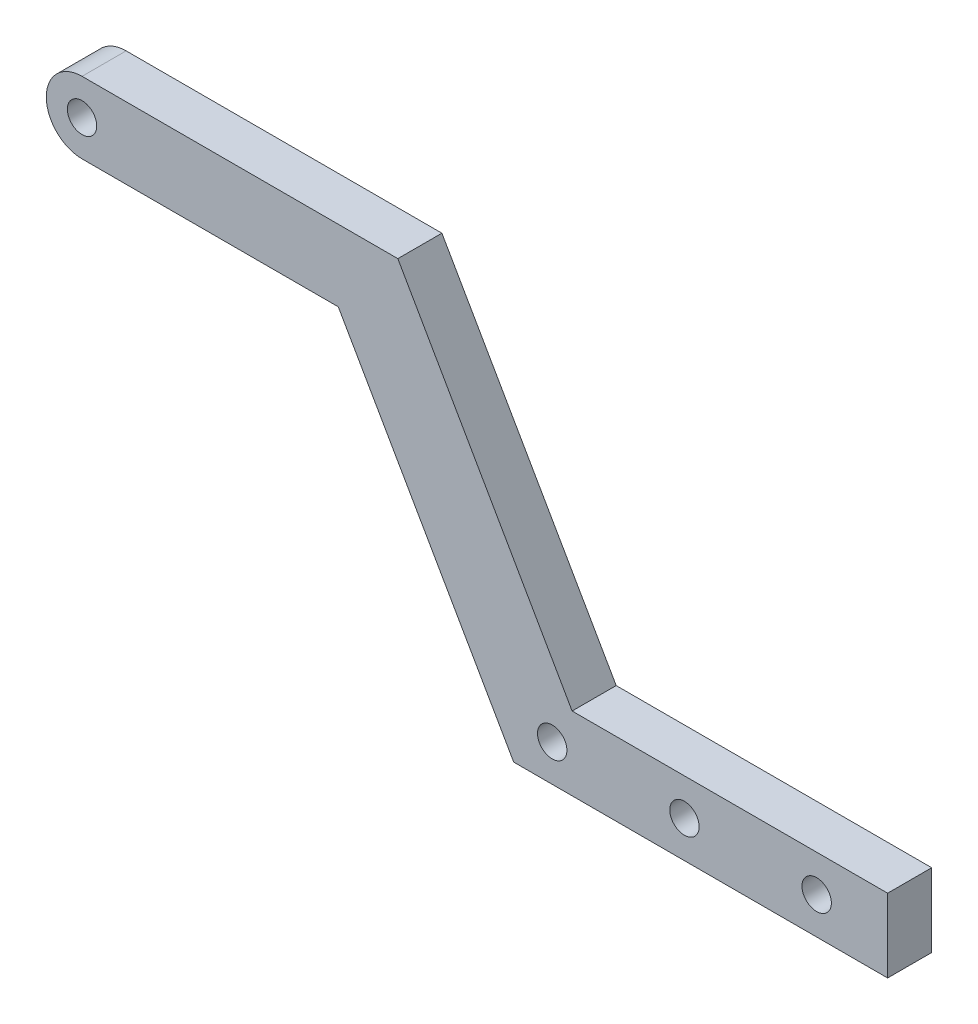
from build123d import *

# Parameters (mm, degrees)
SKETCH_1_R      = 1.000011627
SKETCH_1_R_2    = 1.000010171
SKETCH_1_R_3    = 1.000011034
SKETCH_1_R_4    = 1
EXTRUDE_1_DEPTH = 3


with BuildPart() as part:
    # 草图1 → 凸台-拉伸1 (new body)
    with BuildSketch(Plane.XY):
        with BuildLine():
            Line((28.616000433, -12.942129643), (28.616000433, -7.942129643))
            Line((28.616000433, -7.942129643), (7.141456549, -7.942129643))
            Line((7.141456549, -7.942129643), (-4.721197167, 12.792497513))
            Line((-4.721197167, 12.792497513), (-26.213755395, 12.792497513))
            ThreePointArc((-26.213755395, 12.792497513), (-28.647529033, 10.358723875), (-26.213755395, 7.924950238))
            Line((-26.213755395, 7.924950238), (-8.773244901, 7.924950238))
            Line((-8.773244901, 7.924950238), (3.165187405, -12.942129643))
            Line((3.165187405, -12.942129643), (28.616000433, -12.942129643))
        make_face()
        with Locations((5.786244634, -10.442129643)):
            Circle(SKETCH_1_R, mode=Mode.SUBTRACT)
        with Locations((14.786244634, -10.442129643)):
            Circle(SKETCH_1_R_2, mode=Mode.SUBTRACT)
        with Locations((23.786244634, -10.442129643)):
            Circle(SKETCH_1_R_3, mode=Mode.SUBTRACT)
        with Locations((-26.213755395, 10.358723875)):
            Circle(SKETCH_1_R_4, mode=Mode.SUBTRACT)
    extrude(amount=EXTRUDE_1_DEPTH)


solid = part.part
